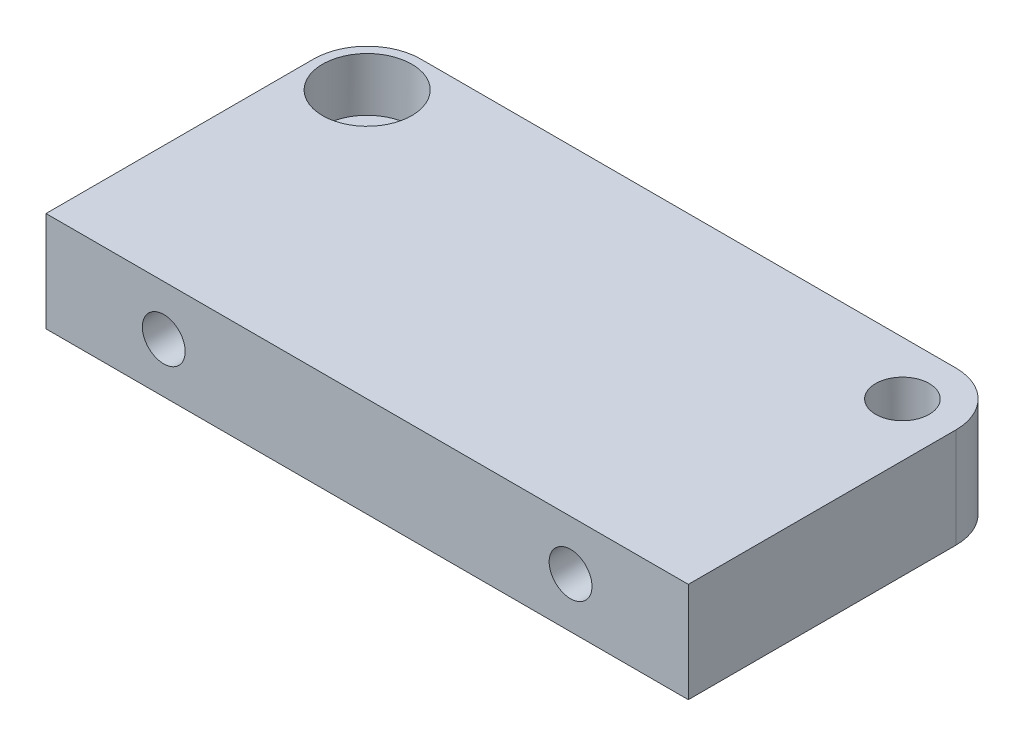
from build123d import *

# Parameters (mm, degrees)
SKETCH_1_W          = 180
SKETCH_1_H          = 28
EXTRUDE_1_DEPTH     = 90
SKETCH_2_R          = 6
CUT_EXTRUDE_1_DEPTH = 60
SKETCH_3_R          = 12.5
SKETCH_3_R_2        = 7.5
CUT_EXTRUDE_2_DEPTH = 30
FILLET_1_R          = 15
EXTRUDE_START       = -13
SKETCH_4_R          = 12.5
SKETCH_4_R_2        = 7
EXTRUDE_2_DEPTH     = 13


with BuildPart() as part:
    # 草图1 → 拉伸1 (new body)
    with BuildSketch(Plane.XY):
        with Locations((90, -14)):
            Rectangle(SKETCH_1_W, SKETCH_1_H)
    extrude(amount=EXTRUDE_1_DEPTH)

    # 草图2 → 切除-拉伸1 (cut)
    with BuildSketch(Plane.XY.offset(90)):
        with Locations((33, -14)):
            Circle(SKETCH_2_R)
        with Locations((147, -14)):
            Circle(SKETCH_2_R)
    extrude(amount=-CUT_EXTRUDE_1_DEPTH, mode=Mode.SUBTRACT)

    # 草图3 → 切除-拉伸2 (cut)
    with BuildSketch(Plane(origin=(0, 0, 0), x_dir=(1, 0, 0), z_dir=(0, 1, 0))):
        with Locations(Location((15, -15, 0), (0, 0, 270))):
            Circle(SKETCH_3_R)
        with Locations(Location((165, -15, 0), (0, 0, 270))):
            Circle(SKETCH_3_R_2)
    extrude(amount=-CUT_EXTRUDE_2_DEPTH, mode=Mode.SUBTRACT)

    # 圆角1
    fillet_1_edges = [part.edges().sort_by_distance(p)[0] for p in [
        (180, -14, 0),
        (0, -14, 0),
    ]]
    fillet(fillet_1_edges, radius=FILLET_1_R)

    # 草图4 → 拉伸2 (add)
    with BuildSketch(Plane.XZ.offset(28).offset(EXTRUDE_START)):
        with Locations(Location((15, 15, 0), (0, 0, 90))):
            Circle(SKETCH_4_R)
        with Locations(Location((15, 15, 0), (0, 0, 270))):
            Circle(SKETCH_4_R_2, mode=Mode.SUBTRACT)
    extrude(amount=EXTRUDE_2_DEPTH)


solid = part.part
